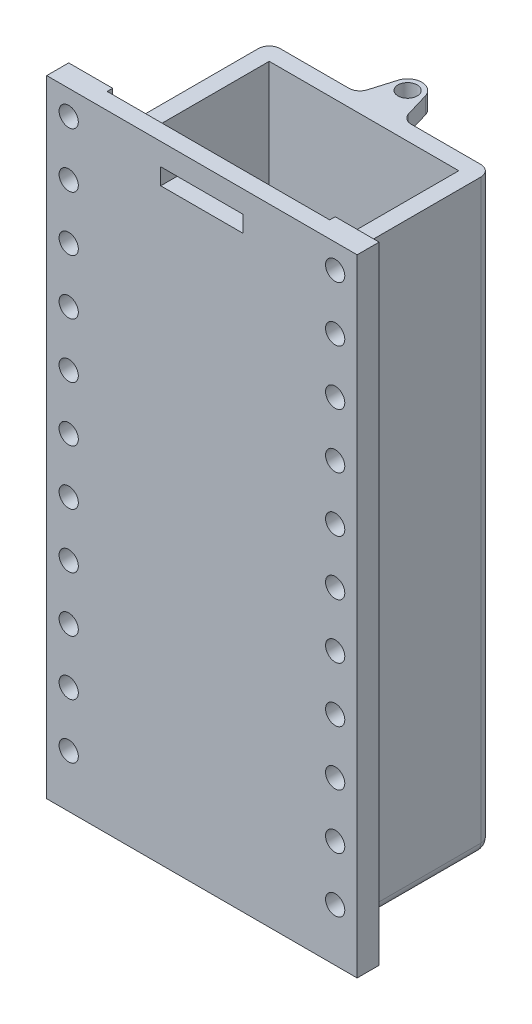
from build123d import *

# Parameters (mm, degrees)
SALIENTE_EXTRUIR1_DEPTH = 114
CROQUIS3_W              = 34.5
CROQUIS3_H              = 26.5
CORTAR_EXTRUIR1_DEPTH   = 111
CROQUIS4_W              = 40.5
CROQUIS4_H              = 7
CORTAR_EXTRUIR2_DEPTH   = 29.5
CROQUIS5_W              = 15
CROQUIS5_H              = 3
CORTAR_EXTRUIR3_DEPTH   = 122.096294328
CROQUIS6_R              = 1.75
CORTAR_EXTRUIR4_DEPTH   = 121.856578224
SALIENTE_EXTRUIR2_DEPTH = 3
CROQUIS8_R              = 1.75
CORTAR_EXTRUIR5_DEPTH   = 118.705083301
REDONDEO1_R             = 2


with BuildPart() as part:
    # Croquis1 → Saliente-Extruir1 (new body)
    with BuildSketch(Plane(origin=(0, 0, 0), x_dir=(1, 0, 0), z_dir=(0, 1, 0))):
        Polygon((0, 0), (-28.25, 0), (-28.25, 4), (-20.25, 4), (-20.25, 32.5), (20.25, 32.5), (20.25, 4), (28.25, 4), (28.25, 0), align=None)
    extrude(amount=SALIENTE_EXTRUIR1_DEPTH)

    # Croquis3 → Cortar-Extruir1 (cut)
    with BuildSketch(Plane(origin=(0, 114, 0), x_dir=(1, 0, 0), z_dir=(0, 1, 0))):
        with Locations((0, 16.25)):
            Rectangle(CROQUIS3_W, CROQUIS3_H)
    extrude(amount=-CORTAR_EXTRUIR1_DEPTH, mode=Mode.SUBTRACT)

    # Croquis4 → Cortar-Extruir2 (cut)
    with BuildSketch(Plane(origin=(0, 0, -32.5), x_dir=(-1, 0, 0), z_dir=(0, 0, -1))):
        with Locations((0, 110.5)):
            Rectangle(CROQUIS4_W, CROQUIS4_H)
    extrude(amount=-CORTAR_EXTRUIR2_DEPTH, mode=Mode.SUBTRACT)

    # Croquis5 → Cortar-Extruir3 (cut, through all)
    with BuildSketch(Plane(origin=(0, 0, -3), x_dir=(-1, 0, 0), z_dir=(0, 0, -1))):
        with Locations((0, 108.5)):
            Rectangle(CROQUIS5_W, CROQUIS5_H)
    extrude(amount=-CORTAR_EXTRUIR3_DEPTH, mode=Mode.SUBTRACT)

    # Croquis6 → Cortar-Extruir4 (cut, through all)
    with BuildSketch(Plane(origin=(0, 0, -4), x_dir=(-1, 0, 0), z_dir=(0, 0, -1))):
        with Locations((-24.25, 109.552589801)):
            Circle(CROQUIS6_R)
        with Locations((-24.25, 99.552589801)):
            Circle(CROQUIS6_R)
        with Locations((-24.25, 89.552589801)):
            Circle(CROQUIS6_R)
        with Locations((-24.25, 79.552589801)):
            Circle(CROQUIS6_R)
        with Locations((-24.25, 69.552589801)):
            Circle(CROQUIS6_R)
        with Locations((-24.25, 59.552589801)):
            Circle(CROQUIS6_R)
        with Locations((-24.25, 49.552589801)):
            Circle(CROQUIS6_R)
        with Locations((-24.25, 39.552589801)):
            Circle(CROQUIS6_R)
        with Locations((-24.25, 29.552589801)):
            Circle(CROQUIS6_R)
        with Locations((-24.25, 19.552589801)):
            Circle(CROQUIS6_R)
        with Locations((-24.25, 9.552589801)):
            Circle(CROQUIS6_R)
        with Locations(Location((24.25, 9.552589801, 0), (0, 0, 180))):
            Circle(CROQUIS6_R)
        with Locations(Location((24.25, 19.552589801, 0), (0, 0, 180))):
            Circle(CROQUIS6_R)
        with Locations(Location((24.25, 29.552589801, 0), (0, 0, 180))):
            Circle(CROQUIS6_R)
        with Locations(Location((24.25, 39.552589801, 0), (0, 0, 180))):
            Circle(CROQUIS6_R)
        with Locations(Location((24.25, 49.552589801, 0), (0, 0, 180))):
            Circle(CROQUIS6_R)
        with Locations(Location((24.25, 59.552589801, 0), (0, 0, 180))):
            Circle(CROQUIS6_R)
        with Locations(Location((24.25, 69.552589801, 0), (0, 0, 180))):
            Circle(CROQUIS6_R)
        with Locations(Location((24.25, 79.552589801, 0), (0, 0, 180))):
            Circle(CROQUIS6_R)
        with Locations(Location((24.25, 89.552589801, 0), (0, 0, 180))):
            Circle(CROQUIS6_R)
        with Locations(Location((24.25, 99.552589801, 0), (0, 0, 180))):
            Circle(CROQUIS6_R)
        with Locations(Location((24.25, 109.552589801, 0), (0, 0, 180))):
            Circle(CROQUIS6_R)
    extrude(amount=-CORTAR_EXTRUIR4_DEPTH, mode=Mode.SUBTRACT)

    # Croquis7 → Saliente-Extruir2 (add)
    with BuildSketch(Plane(origin=(0, 107, 0), x_dir=(1, 0, 0), z_dir=(0, 1, 0))):
        with BuildLine():
            Line((-4.257816839, 32.5), (-2.550631192, 38.239212117))
            ThreePointArc((-2.550631192, 38.239212117), (-0.065549886, 40.092694284), (2.41953142, 38.239212117))
            Line((2.41953142, 38.239212117), (4.126717066, 32.5))
            Line((4.126717066, 32.5), (-4.257816839, 32.5))
        make_face()
    extrude(amount=-SALIENTE_EXTRUIR2_DEPTH)

    # Croquis8 → Cortar-Extruir5 (cut, through all)
    with BuildSketch(Plane(origin=(0, 107, 0), x_dir=(1, 0, 0), z_dir=(0, 1, 0))):
        with Locations(Location((-0.065549886, 37.5, 0), (0, 0, 270))):
            Circle(CROQUIS8_R)
    extrude(amount=-CORTAR_EXTRUIR5_DEPTH, mode=Mode.SUBTRACT)

    # Redondeo1
    redondeo1_edges = [part.edges().sort_by_distance(p)[0] for p in [
        (0, 0, -32.5),
        (20.25, 0, -18.25),
        (-0.065549886, 104, -32.5),
        (4.126717066, 105.5, -32.5),
        (-4.257816839, 105.5, -32.5),
        (-17.25, 3, -16.25),
        (-20.25, 53.5, -32.5),
        (20.25, 53.5, -32.5),
    ]]
    fillet(redondeo1_edges, radius=REDONDEO1_R)


solid = part.part
